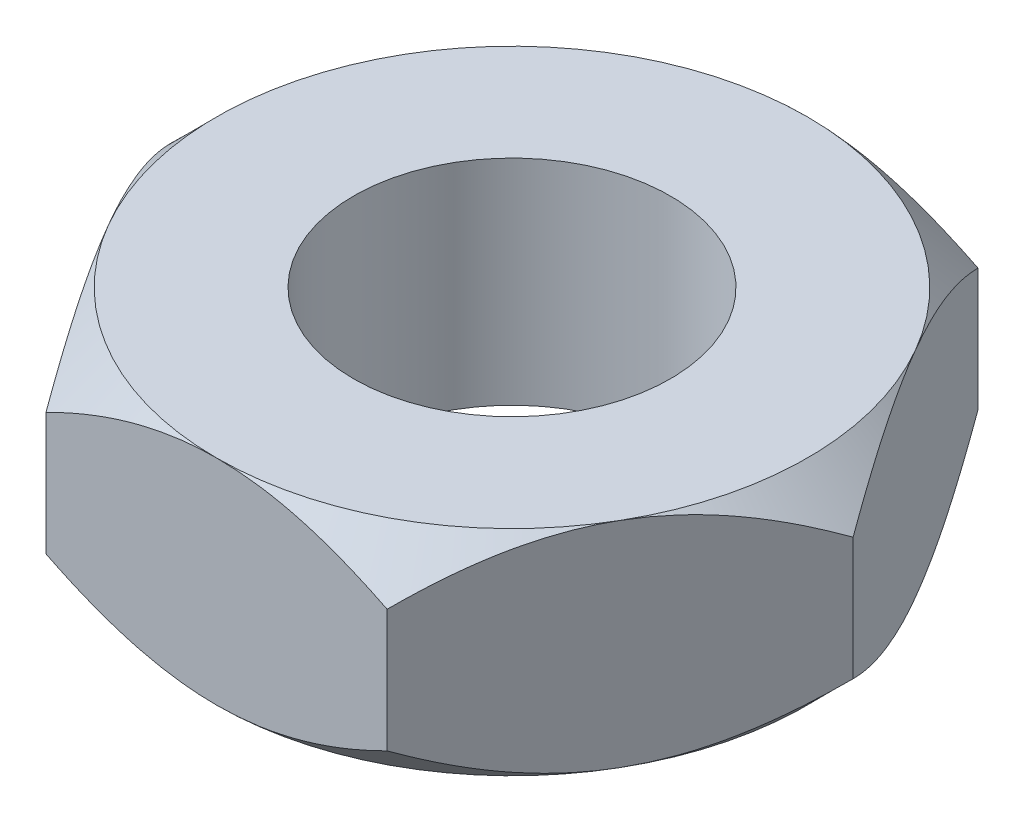
from build123d import *

# Parameters (mm, degrees)
SKETCH1_R               = 18.5
BOSS_EXTRUDE1_DEPTH     = 12.5
SKETCH2_OUTSIDE_W       = 183.338
SKETCH2_OUTSIDE_H       = 172.664
SKETCH2_OUTSIDE_R       = 34.5
CUT_EXTRUDE3_DEPTH      = 40
CUT_EXTRUDE3_DRAFT      = -45
MIRROR1_COPY_1_SKETCH_W = 183.338
MIRROR1_COPY_1_SKETCH_H = 172.664
MIRROR1_COPY_1_SKETCH_R = 34.5
MIRROR1_COPY_1_DEPTH    = 40
MIRROR1_COPY_1_DRAFT    = -45


with BuildPart() as part:
    # Sketch1 → Boss-Extrude1 (new, symmetric)
    with BuildSketch(Plane(origin=(0, 0, 0), x_dir=(1, 0, 0), z_dir=(0, 1, 0))):
        Polygon((-39.837168574, 0), (-19.918584287, -34.5), (19.918584287, -34.5), (39.837168574, 0), (19.918584287, 34.5), (-19.918584287, 34.5), align=None)
        with Locations(Location((0, 0, 0), (0, 0, 270))):
            Circle(SKETCH1_R, mode=Mode.SUBTRACT)
    extrude(amount=BOSS_EXTRUDE1_DEPTH, both=True)


with BuildPart() as cut_extrude3_tool:
    # Sketch2 outside → Cut-Extrude3 (with draft: the straight prism first)
    with BuildSketch(Plane(origin=(0, 12.5, 0), x_dir=(1, 0, 0), z_dir=(0, 1, 0))):
        Rectangle(SKETCH2_OUTSIDE_W, SKETCH2_OUTSIDE_H)
        Circle(SKETCH2_OUTSIDE_R, mode=Mode.SUBTRACT)
    extrude(amount=-CUT_EXTRUDE3_DEPTH)
    # Cut-Extrude3: the draft: its side faces are tilted about the plane it starts from
    cut_extrude3_sides = [cut_extrude3_tool.faces().sort_by_distance(p)[0] for p in [
        (0, -7.5, 86.332),
        (91.669, -7.5, 0),
        (0, -7.5, -86.332),
        (-91.669, -7.5, 0),
        (-34.5, -7.5, 0),
    ]]
    draft(cut_extrude3_sides, Plane(origin=(0, 12.5, 0), x_dir=(1, 0, 0), z_dir=(0, 1, 0)), CUT_EXTRUDE3_DRAFT)


with BuildPart() as part_1:
    add(part.part)

    # Cut-Extrude3: cut by cut_extrude3_tool
    add(cut_extrude3_tool.part, mode=Mode.SUBTRACT)


with BuildPart() as mirror1_copy_1_tool:
    # Mirror1 copy 1 sketch → Mirror1 copy 1 (with draft: the straight prism first)
    with BuildSketch(Plane.XZ.offset(12.5)):
        Rectangle(MIRROR1_COPY_1_SKETCH_W, MIRROR1_COPY_1_SKETCH_H)
        Circle(MIRROR1_COPY_1_SKETCH_R, mode=Mode.SUBTRACT)
    extrude(amount=-MIRROR1_COPY_1_DEPTH)
    # Mirror1 copy 1: the draft: its side faces are tilted about the plane it starts from
    mirror1_copy_1_sides = [mirror1_copy_1_tool.faces().sort_by_distance(p)[0] for p in [
        (0, 7.5, 86.332),
        (91.669, 7.5, 0),
        (0, 7.5, -86.332),
        (-91.669, 7.5, 0),
        (-34.5, 7.5, 0),
    ]]
    draft(mirror1_copy_1_sides, Plane.XZ.offset(12.5), MIRROR1_COPY_1_DRAFT)


with BuildPart() as part_2:
    add(part_1.part)

    # Mirror1 copy 1: cut by mirror1_copy_1_tool
    add(mirror1_copy_1_tool.part, mode=Mode.SUBTRACT)


solid = part_2.part
